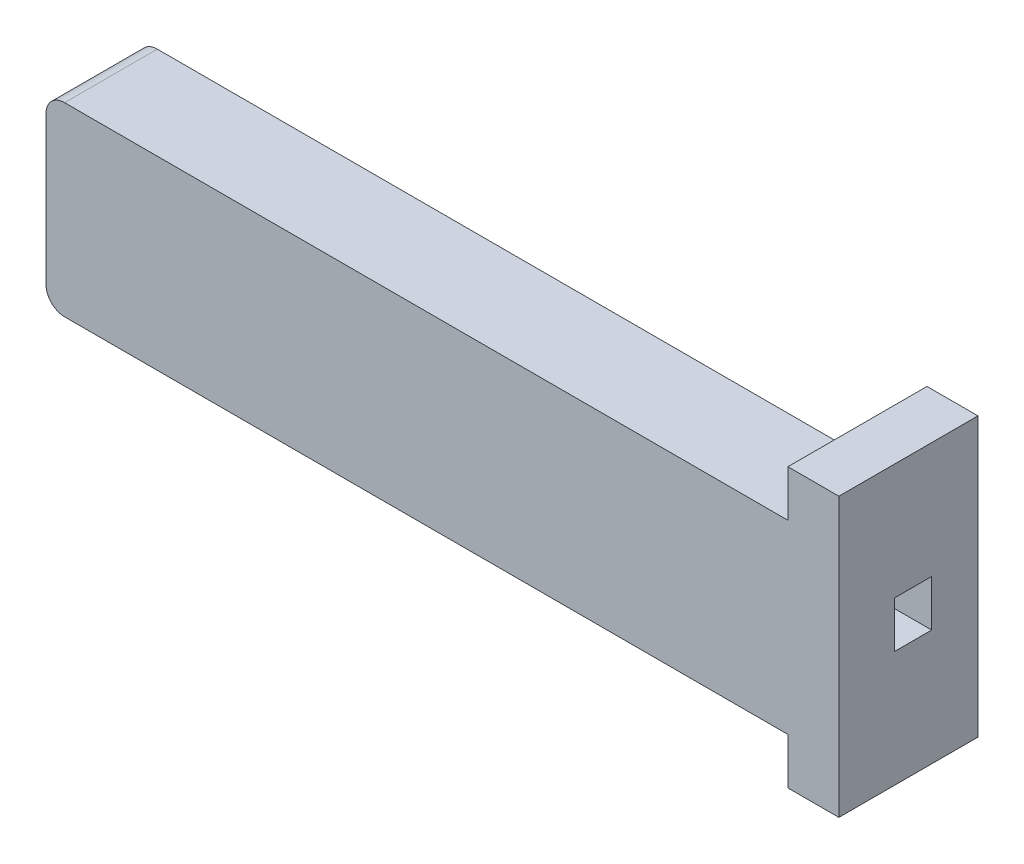
from build123d import *

# Parameters (mm, degrees)
SKETCH_1_W          = 80
SKETCH_1_H          = 20
EXTRUDE_1_DEPTH     = 10
FILLET_1_R          = 2
EXTRUDE_2_DEPTH     = 5.5
SKETCH_3_W          = 4
SKETCH_3_H          = 5
CUT_EXTRUDE_1_DEPTH = 77.5
SKETCH_4_W          = 3
SKETCH_4_H          = 10
CUT_EXTRUDE_2_DEPTH = 5
FILLET_2_R          = 2


with BuildPart() as part:
    # Эскиз1 → Бобышка-Вытянуть1 (new body)
    with BuildSketch(Plane.XY):
        with Locations((-31.304142693, -21.180034522)):
            Rectangle(SKETCH_1_W, SKETCH_1_H)
    extrude(amount=EXTRUDE_1_DEPTH)

    # Скругление1
    fillet_1_edges = [part.edges().sort_by_distance(p)[0] for p in [
        (-71.304142693, -11.180034522, 5),
        (-71.304142693, -31.180034522, 5),
    ]]
    fillet(fillet_1_edges, radius=FILLET_1_R)

    # Эскиз2 → Бобышка-Вытянуть2 (add)
    with BuildSketch(Plane(origin=(8.695857307, 0, 0), x_dir=(0, 0, -1), z_dir=(1, 0, 0))):
        Polygon((-10, -31.180034522), (-10, -36.180034522), (5, -36.180034522), (5, -6.180034522), (-10, -6.180034522), (-10, -11.180034522), align=None)
    extrude(amount=EXTRUDE_2_DEPTH)

    # Эскиз3 → Вырез-Вытянуть1 (cut)
    with BuildSketch(Plane(origin=(14.195857307, 0, 0), x_dir=(0, 0, -1), z_dir=(1, 0, 0))):
        with Locations((-2, -21.180034522)):
            Rectangle(SKETCH_3_W, SKETCH_3_H)
    extrude(amount=-CUT_EXTRUDE_1_DEPTH, mode=Mode.SUBTRACT)

    # Эскиз4 → Вырез-Вытянуть2 (cut)
    with BuildSketch(Plane(origin=(0, 0, 0), x_dir=(-1, 0, 0), z_dir=(0, 0, -1))):
        with Locations((-3.695857307, -21.180034522)):
            Rectangle(SKETCH_4_W, SKETCH_4_H)
        with Locations((56.304142693, -21.180034522)):
            Rectangle(SKETCH_4_W, SKETCH_4_H)
        with Locations((44.304142693, -21.180034522)):
            Rectangle(SKETCH_4_W, SKETCH_4_H)
        with Locations((32.304142693, -21.180034522)):
            Rectangle(SKETCH_4_W, SKETCH_4_H)
        with Locations((20.304142693, -21.180034522)):
            Rectangle(SKETCH_4_W, SKETCH_4_H)
        with Locations((8.304142693, -21.180034522)):
            Rectangle(SKETCH_4_W, SKETCH_4_H)
    extrude(amount=-CUT_EXTRUDE_2_DEPTH, mode=Mode.SUBTRACT)

    # Скругление2
    fillet_2_edges = [part.edges().sort_by_distance(p)[0] for p in [
        (-63.304142693, -23.680034522, 2),
        (-63.304142693, -21.180034522, 4),
        (-60.554142693, -23.680034522, 4),
        (-63.304142693, -18.680034522, 2),
        (-60.554142693, -18.680034522, 4),
        (-50.304142693, -18.680034522, 4),
        (-38.304142693, -18.680034522, 4),
        (-26.304142693, -18.680034522, 4),
        (-14.304142693, -18.680034522, 4),
        (-2.304142693, -18.680034522, 4),
        (-50.304142693, -23.680034522, 4),
        (-38.304142693, -23.680034522, 4),
        (-26.304142693, -23.680034522, 4),
        (-14.304142693, -23.680034522, 4),
        (-2.304142693, -23.680034522, 4),
    ]]
    fillet(fillet_2_edges, radius=FILLET_2_R)


solid = part.part
